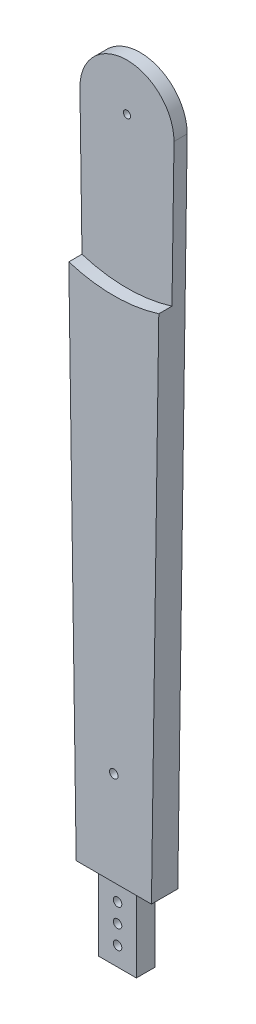
from build123d import *

# Parameters (mm, degrees)
BOSS_EXTRUDE3_DEPTH = 7
SKETCH17_R          = 80
CUT_EXTRUDE9_DEPTH  = 7
SKETCH18_R          = 2.25
CUT_EXTRUDE10_DEPTH = 14
SKETCH19_R          = 1.9
CUT_EXTRUDE11_DEPTH = 7
SKETCH14_W          = 20
SKETCH14_H          = 10
BOSS_EXTRUDE4_DEPTH = 40
SKETCH20_R          = 2.25
CUT_EXTRUDE12_DEPTH = 10
LPATTERN1_COUNT     = 3
LPATTERN1_PITCH     = 10


with BuildPart() as part:
    # Sketch7 → Boss-Extrude3 (new, symmetric)
    with BuildSketch(Plane.XY):
        with BuildLine():
            ThreePointArc((25, 0), (0, 25), (-25, 0))
            Line((-25, 0), (-24.989798, -0.714139971))
            ThreePointArc((-24.989798, -0.714139971), (0, -25), (24.989798, -0.714139971))
            Line((24.989798, -0.714139971), (25, 0))
        make_face()
        with BuildLine():
            ThreePointArc((24.989798, -0.714139971), (0, -25), (-24.989798, -0.714139971))
            Line((-24.989798, -0.714139971), (-20, -350))
            Line((-20, -350), (20, -350))
            Line((20, -350), (24.989798, -0.714139971))
        make_face()
    extrude(amount=BOSS_EXTRUDE3_DEPTH, both=True)

    # Sketch17 → Cut-Extrude9 (cut)
    with BuildSketch(Plane.XY.offset(7)):
        Circle(SKETCH17_R)
    extrude(amount=-CUT_EXTRUDE9_DEPTH, mode=Mode.SUBTRACT)

    # Sketch18 → Cut-Extrude10 (cut)
    with BuildSketch(Plane.XY.offset(7)):
        with Locations((0, -300)):
            Circle(SKETCH18_R)
    extrude(amount=-CUT_EXTRUDE10_DEPTH, mode=Mode.SUBTRACT)

    # Sketch19 → Cut-Extrude11 (cut)
    with BuildSketch(Plane.XY):
        Circle(SKETCH19_R)
    extrude(amount=-CUT_EXTRUDE11_DEPTH, mode=Mode.SUBTRACT)

    # Sketch14 → Boss-Extrude4 (add)
    with BuildSketch(Plane.XZ.offset(350)):
        Rectangle(SKETCH14_W, SKETCH14_H)
    extrude(amount=BOSS_EXTRUDE4_DEPTH)

    # Sketch20 → Cut-Extrude12 (cut)
    with BuildSketch(Plane.XY.offset(5)):
        with Locations((0, -360)):
            Circle(SKETCH20_R)
    cut_extrude12 = extrude(amount=-CUT_EXTRUDE12_DEPTH, mode=Mode.SUBTRACT)

    # LPattern1: Cut-Extrude12 ×3
    with Locations(*[(0, -i * LPATTERN1_PITCH, 0) for i in range(1, LPATTERN1_COUNT)]):
        add(cut_extrude12, mode=Mode.SUBTRACT)


solid = part.part
